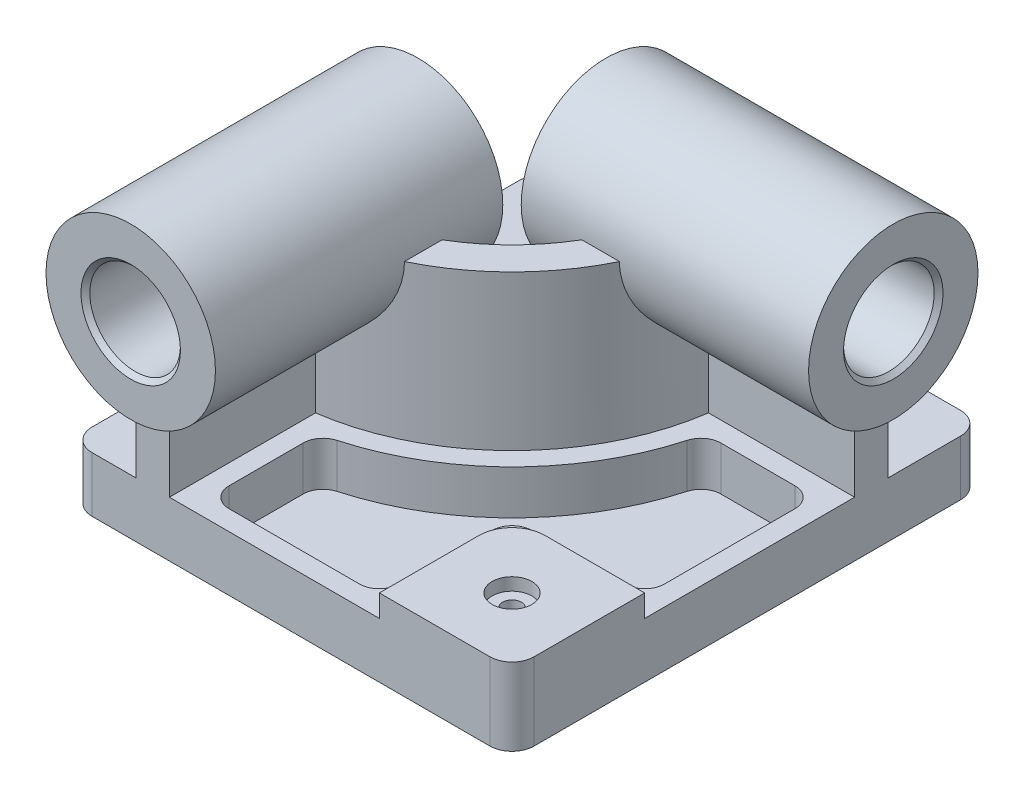
from build123d import *

# Parameters (mm, degrees)
BOSS_EXTRUDE1_DEPTH                     = 25
BOSS_EXTRUDE2_START                     = -25
BOSS_EXTRUDE2_DEPTH                     = 35
CBORE_FOR_M8_HEX_HEAD_BOLT2_D           = 8.4
CBORE_FOR_M8_HEX_HEAD_BOLT2_CBORE_D     = 18.01
CBORE_FOR_M8_HEX_HEAD_BOLT2_CBORE_DEPTH = 5.68
CUT_EXTRUDE1_DEPTH                      = 20
BOSS_EXTRUDE3_START                     = -25
BOSS_EXTRUDE3_DEPTH                     = 95
SKETCH10_R                              = 38.33
SKETCH10_R_2                            = 20.5
BOSS_EXTRUDE4_DEPTH                     = 120
CUT_EXTRUDE2_DEPTH                      = 130
SKETCH12_R                              = 38.33
SKETCH12_R_2                            = 20.5
BOSS_EXTRUDE5_DEPTH                     = 120
CUT_EXTRUDE3_DEPTH                      = 130
BOSS_EXTRUDE6_START                     = 10
SKETCH10_2_R                            = 38.33
SKETCH10_2_R_2                          = 20.5
BOSS_EXTRUDE6_DEPTH                     = 10
BOSS_EXTRUDE7_START                     = 10
SKETCH12_3_R                            = 38.33
SKETCH12_3_R_2                          = 20.5
BOSS_EXTRUDE7_DEPTH                     = 10
CHAMFER1_SIZE                           = 2


with BuildPart() as part:
    # Sketch1 → Boss-Extrude1 (new body)
    with BuildSketch(Plane(origin=(0, 0, 0), x_dir=(1, 0, 0), z_dir=(0, 1, 0))):
        with BuildLine():
            Line((10, 0), (190, 0))
            ThreePointArc((190, 0), (197.071067812, 2.928932188), (200, 10))
            Line((200, 10), (200, 203))
            ThreePointArc((200, 203), (197.071067812, 210.071067812), (190, 213))
            Line((190, 213), (10, 213))
            ThreePointArc((10, 213), (2.928932188, 210.071067812), (0, 203))
            Line((0, 203), (0, 10))
            ThreePointArc((0, 10), (2.928932188, 2.928932188), (10, 0))
        make_face()
    extrude(amount=BOSS_EXTRUDE1_DEPTH)

    # Sketch2 → Boss-Extrude2 (add)
    with BuildSketch(Plane(origin=(0, 25, 0), x_dir=(1, 0, 0), z_dir=(0, 1, 0)).offset(BOSS_EXTRUDE2_START)):
        with BuildLine():
            Line((155, 60), (200, 60))
            Line((200, 60), (200, 10))
            ThreePointArc((200, 10), (197.071067812, 2.928932188), (190, 0))
            Line((190, 0), (140, 0))
            Line((140, 0), (140, 45))
            ThreePointArc((140, 45), (144.393398282, 55.606601718), (155, 60))
        make_face()
    extrude(amount=BOSS_EXTRUDE2_DEPTH)

    # CBORE for M8 Hex Head Bolt2 (through all)
    with Locations(Plane(origin=(170, 35, -30), x_dir=(0, 0, 1), z_dir=(0, 1, 0))):
        with Locations((0, 0)):
            CounterBoreHole(CBORE_FOR_M8_HEX_HEAD_BOLT2_D / 2, CBORE_FOR_M8_HEX_HEAD_BOLT2_CBORE_D / 2, CBORE_FOR_M8_HEX_HEAD_BOLT2_CBORE_DEPTH)

    # Sketch9 → Cut-Extrude1 (cut)
    with BuildSketch(Plane(origin=(0, 25, 0), x_dir=(1, 0, 0), z_dir=(0, 1, 0))):
        with BuildLine():
            ThreePointArc((54, 51.509494051), (55.833002466, 56.953219461), (60.585365854, 60.179531072))
            ThreePointArc((60.585365854, 60.179531072), (110.610173055, 89.389826945), (139.820468928, 139.414634146))
            ThreePointArc((139.820468928, 139.414634146), (143.046780539, 144.166997534), (148.490505949, 146))
            Line((148.490505949, 146), (182, 146))
            ThreePointArc((182, 146), (188.363961031, 143.363961031), (191, 137))
            Line((191, 137), (191, 78))
            ThreePointArc((191, 78), (188.363961031, 71.636038969), (182, 69))
            Line((182, 69), (140, 69))
            ThreePointArc((140, 69), (133.636038969, 66.363961031), (131, 60))
            Line((131, 60), (131, 18))
            ThreePointArc((131, 18), (128.363961031, 11.636038969), (122, 9))
            Line((122, 9), (63, 9))
            ThreePointArc((63, 9), (56.636038969, 11.636038969), (54, 18))
            Line((54, 18), (54, 51.509494051))
        make_face()
    extrude(amount=-CUT_EXTRUDE1_DEPTH, mode=Mode.SUBTRACT)

    # Sketch9<3> → Boss-Extrude3 (add)
    with BuildSketch(Plane(origin=(0, 25, 0), x_dir=(1, 0, 0), z_dir=(0, 1, 0)).offset(BOSS_EXTRUDE3_START)):
        with BuildLine():
            Line((200, 155), (200, 170))
            Line((200, 170), (120, 170))
            ThreePointArc((120, 170), (93.639610307, 106.360389693), (30, 80))
            Line((30, 80), (30, 0))
            Line((30, 0), (45, 0))
            Line((45, 0), (45, 66.076951546))
            ThreePointArc((45, 66.076951546), (104.246212025, 95.753787975), (133.923048454, 155))
            Line((133.923048454, 155), (200, 155))
        make_face()
    extrude(amount=BOSS_EXTRUDE3_DEPTH)

    # Sketch10 → Boss-Extrude4 (add)
    with BuildSketch(Plane(origin=(200, 0, 0), x_dir=(0, 0, -1), z_dir=(1, 0, 0))):
        with Locations((162.5, 95)):
            Circle(SKETCH10_R)
        with Locations((162.5, 95)):
            Circle(SKETCH10_R_2, mode=Mode.SUBTRACT)
    extrude(amount=-BOSS_EXTRUDE4_DEPTH)

    # Sketch11 → Cut-Extrude2 (cut)
    with BuildSketch(Plane(origin=(200, 0, 0), x_dir=(0, 0, -1), z_dir=(1, 0, 0))):
        with BuildLine():
            Line((142, 95), (170, 95))
            Line((170, 95), (170, 75.921215972))
            ThreePointArc((170, 75.921215972), (150.956603619, 78.058925654), (142, 95))
        make_face()
    extrude(amount=-CUT_EXTRUDE2_DEPTH, mode=Mode.SUBTRACT)

    # Sketch12 → Boss-Extrude5 (add)
    with BuildSketch(Plane.XY):
        with Locations((37.5, 95)):
            Circle(SKETCH12_R)
        with Locations((37.5, 95)):
            Circle(SKETCH12_R_2, mode=Mode.SUBTRACT)
    extrude(amount=-BOSS_EXTRUDE5_DEPTH)

    # Sketch13 → Cut-Extrude3 (cut)
    with BuildSketch(Plane.XY):
        with BuildLine():
            Line((25.688032589, 78.245077563), (25.688032589, 100.102181985))
            Line((25.688032589, 100.102181985), (51.572180065, 100.102181985))
            Line((51.572180065, 100.102181985), (58, 95))
            ThreePointArc((58, 95), (46.936754423, 76.80116306), (25.688032589, 78.245077563))
        make_face()
    extrude(amount=-CUT_EXTRUDE3_DEPTH, mode=Mode.SUBTRACT)

    # Sketch10<2> → Boss-Extrude6 (add)
    with BuildSketch(Plane(origin=(200, 0, 0), x_dir=(0, 0, -1), z_dir=(1, 0, 0)).offset(BOSS_EXTRUDE6_START)):
        with Locations((162.5, 95)):
            Circle(SKETCH10_2_R)
        with Locations((162.5, 95)):
            Circle(SKETCH10_2_R_2, mode=Mode.SUBTRACT)
    extrude(amount=-BOSS_EXTRUDE6_DEPTH)

    # Sketch12<3> → Boss-Extrude7 (add)
    with BuildSketch(Plane.XY.offset(BOSS_EXTRUDE7_START)):
        with Locations((37.5, 95)):
            Circle(SKETCH12_3_R)
        with Locations((37.5, 95)):
            Circle(SKETCH12_3_R_2, mode=Mode.SUBTRACT)
    extrude(amount=-BOSS_EXTRUDE7_DEPTH)

    # Chamfer1
    chamfer1_edges = [part.edges().sort_by_distance(p)[0] for p in [
        (80, 95, -142),
        (17, 95, -120),
        (210, 95, -142),
        (17, 95, 10),
    ]]
    chamfer(chamfer1_edges, length=CHAMFER1_SIZE)


solid = part.part
